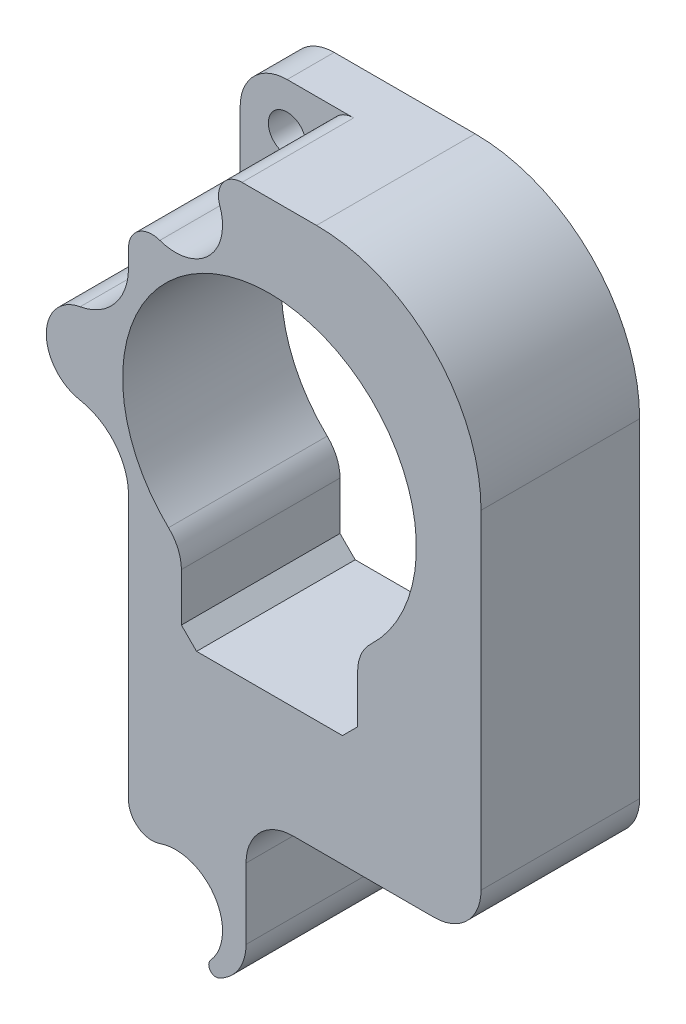
from build123d import *

# Parameters (mm, degrees)
EXTRUDE_1_DEPTH             = 13.5
CUT_EXTRUDE_1_DEPTH         = 9.5
SKETCH_3_W                  = 10
SKETCH_3_H                  = 13.5
EXTRUDE_2_DEPTH             = 11.133399735
SKETCH_4_W                  = 13.5
SKETCH_4_H                  = 46
EXTRUDE_3_DEPTH             = 20
CUT_EXTRUDE_2_DEPTH         = 9.5
CUT_EXTRUDE_3_DEPTH         = 55.538976888
SKETCH_7_W                  = 12.5
SKETCH_7_H                  = 13.5
HOLE_WIZARD_3_2_3_2_1_D     = 3.2
HOLE_WIZARD_3_2_3_2_1_DEPTH = 13.5
CHAMFER_1_SIZE              = 1.292893219
FILLET_1_R                  = 3.5
FILLET_2_R                  = 4
FILLET_3_R                  = 14


with BuildPart() as part:
    # 草图1 → 凸台-拉伸1 (new body)
    with BuildSketch(Plane.XY.offset(17)):
        with BuildLine():
            Line((13.5, -30), (19.5, -30))
            ThreePointArc((19.5, -30), (22.328427125, -28.828427125), (23.5, -26))
            Line((23.5, -26), (23.5, 18.866600265))
            Line((23.5, 18.866600265), (13.5, 18.866600265))
            ThreePointArc((13.5, 18.866600265), (12.334824944, 15.658155526), (9.382352941, 13.945070697))
            ThreePointArc((9.382352941, 13.945070697), (6.5, 10.5), (9.382352941, 7.054929303))
            ThreePointArc((9.382352941, 7.054929303), (12.334824944, 5.341844474), (13.5, 2.133399735))
            Line((13.5, 2.133399735), (13.5, -30))
        make_face()
    extrude(amount=-EXTRUDE_1_DEPTH)

    # 草图2 → 切除-拉伸1 (cut)
    with BuildSketch(Plane.XY.offset(17)):
        with BuildLine():
            Line((13.5, -20.343145751), (13.5, -30))
            Line((13.5, -30), (19.5, -30))
            ThreePointArc((19.5, -30), (20.366987609, -29.904911329), (21.192754868, -29.624166243))
            ThreePointArc((21.192754868, -29.624166243), (20.446463344, -29.435660891), (20.481374199, -28.666722312))
            ThreePointArc((20.481374199, -28.666722312), (20.822775499, -23.773082178), (16.166666667, -22.228763834))
            ThreePointArc((16.166666667, -22.228763834), (14.345299462, -21.976138912), (13.5, -20.343145751))
        make_face()
    extrude(amount=-CUT_EXTRUDE_1_DEPTH, mode=Mode.SUBTRACT)

    # 草图3 → 凸台-拉伸2 (add)
    with BuildSketch(Plane(origin=(0, 18.866600265, 0), x_dir=(-1, 0, 0), z_dir=(0, 1, 0))):
        with Locations((-18.5, 10.25)):
            Rectangle(SKETCH_3_W, SKETCH_3_H)
    extrude(amount=EXTRUDE_2_DEPTH)

    # 草图4 → 凸台-拉伸3 (add)
    with BuildSketch(Plane(origin=(23.5, 0, 0), x_dir=(0, 0, -1), z_dir=(1, 0, 0))):
        with Locations((-10.25, 7)):
            Rectangle(SKETCH_4_W, SKETCH_4_H)
    extrude(amount=EXTRUDE_3_DEPTH)

    # 草图5 → 切除-拉伸2 (cut)
    with BuildSketch(Plane.XY.offset(17)):
        with BuildLine():
            Line((23.156854249, 30), (13.5, 30))
            Line((13.5, 30), (13.5, 20.343145751))
            ThreePointArc((13.5, 20.343145751), (14.345299462, 21.976138912), (16.166666667, 22.228763834))
            ThreePointArc((16.166666667, 22.228763834), (20.328427125, 23.171572875), (21.271236166, 27.333333333))
            ThreePointArc((21.271236166, 27.333333333), (21.523861088, 29.154700538), (23.156854249, 30))
        make_face()
    extrude(amount=-CUT_EXTRUDE_2_DEPTH, mode=Mode.SUBTRACT)

    # 草图6 → 切除-拉伸3 (cut, through all)
    with BuildSketch(Plane(origin=(0, 0, 3.5), x_dir=(-1, 0, 0), z_dir=(0, 0, -1))):
        with BuildLine():
            Line((-33, -6.5), (-18, -6.5))
            Line((-18, -6.5), (-18, 0.5))
            ThreePointArc((-18, 0.5), (-25.5, -2), (-33, 0.5))
            Line((-33, 0.5), (-33, -6.5))
        make_face()
    extrude(amount=-CUT_EXTRUDE_3_DEPTH, mode=Mode.SUBTRACT)

    # 草图7 → 切除-旋转1 (revolve, cut)
    with BuildSketch(Plane(origin=(0, 10.5, 0), x_dir=(1, 0, 0), z_dir=(0, 1, 0))):
        with Locations((31.75, -10.25)):
            Rectangle(SKETCH_7_W, SKETCH_7_H)
    revolve(axis=Axis((25.5, 10.5, 3.5), (0, 0, 1)), mode=Mode.SUBTRACT)

    # Ø3.2 (3.2) 直径孔1
    with Locations(Plane(origin=(0, 0, 3.5), x_dir=(-1, 0, 0), z_dir=(0, 0, -1))):
        with Locations((-17.5, 26), (-17.5, -26)):
            Hole(HOLE_WIZARD_3_2_3_2_1_D / 2, depth=HOLE_WIZARD_3_2_3_2_1_DEPTH)

    # 倒角1
    chamfer_1_edges = [part.edges().sort_by_distance(p)[0] for p in [
        (33, -6.5, 10.25),
        (18, -6.5, 10.25),
    ]]
    chamfer(chamfer_1_edges, length=CHAMFER_1_SIZE)

    # 圆角1
    fillet_1_edges = [part.edges().sort_by_distance(p)[0] for p in [
        (33, 0.5, 10.25),
        (18, 0.5, 10.25),
    ]]
    fillet(fillet_1_edges, radius=FILLET_1_R)

    # 圆角2
    fillet_2_edges = [part.edges().sort_by_distance(p)[0] for p in [
        (13.5, -30, 5.5),
        (13.5, 30, 5.5),
        (23.5, -16, 10.25),
        (43.5, -16, 10.25),
    ]]
    fillet(fillet_2_edges, radius=FILLET_2_R)

    # 圆角3
    fillet_3_edges = [part.edges().sort_by_distance(p)[0] for p in [
        (43.5, 30, 10.25),
    ]]
    fillet(fillet_3_edges, radius=FILLET_3_R)


solid = part.part
